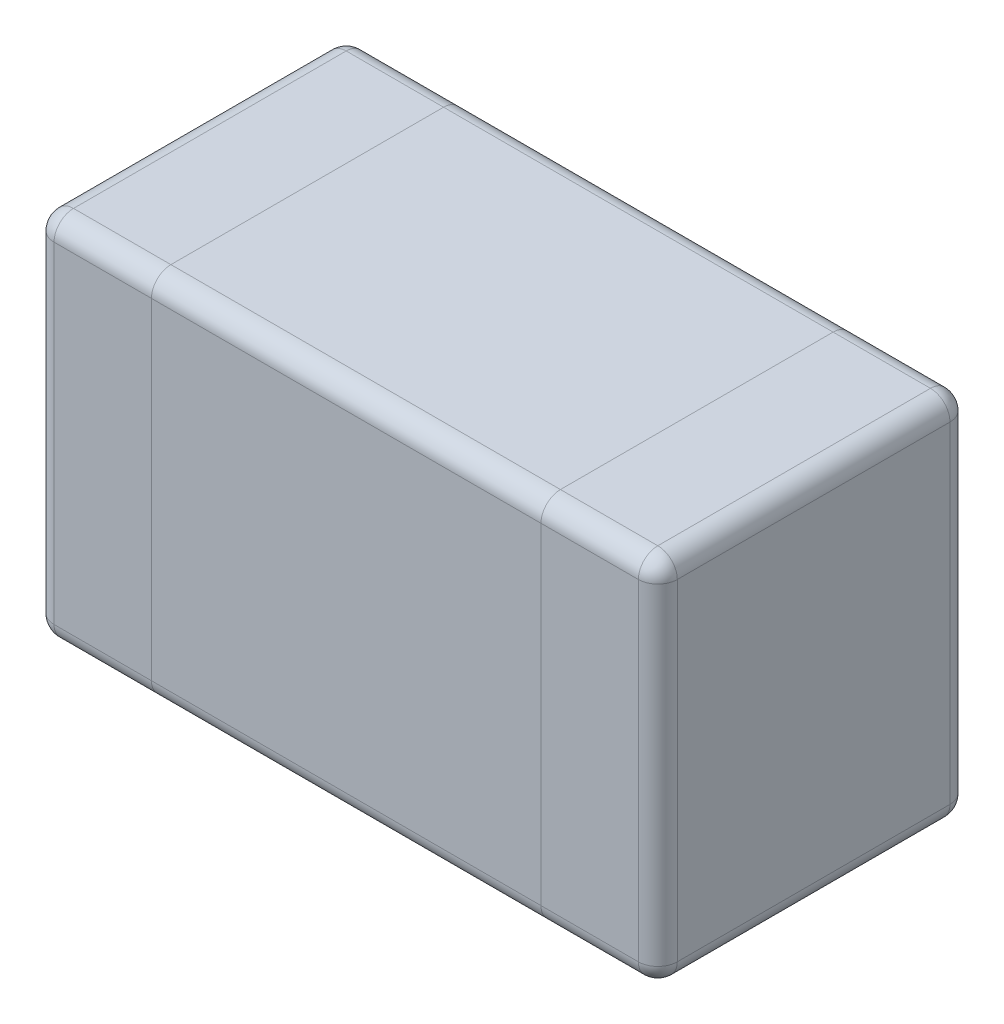
from build123d import *

# Parameters (mm, degrees)
SKETCH1_W      = 1.6
SKETCH1_H      = 0.8
EXTRUDE1_DEPTH = 0.95
FILLET1_R      = 0.05


with BuildPart() as part:
    # Sketch1 → Extrude1 (new body)
    with BuildSketch(Plane(origin=(0, 0, 0), x_dir=(1, 0, 0), z_dir=(0, 1, 0))):
        Rectangle(SKETCH1_W, SKETCH1_H)
    extrude(amount=EXTRUDE1_DEPTH)

    # Fillet1
    fillet1_edges = [part.edges().sort_by_distance(p)[0] for p in [
        (-0.8, 0.95, 0),
        (0, 0.95, 0.4),
        (0.8, 0.95, 0),
        (0, 0, 0.4),
        (-0.8, 0, 0),
        (0, 0, -0.4),
        (0.8, 0, 0),
        (0, 0.95, -0.4),
        (0.8, 0.475, 0.4),
        (-0.8, 0.475, 0.4),
        (-0.8, 0.475, -0.4),
        (0.8, 0.475, -0.4),
    ]]
    fillet(fillet1_edges, radius=FILLET1_R)


solid = part.part
